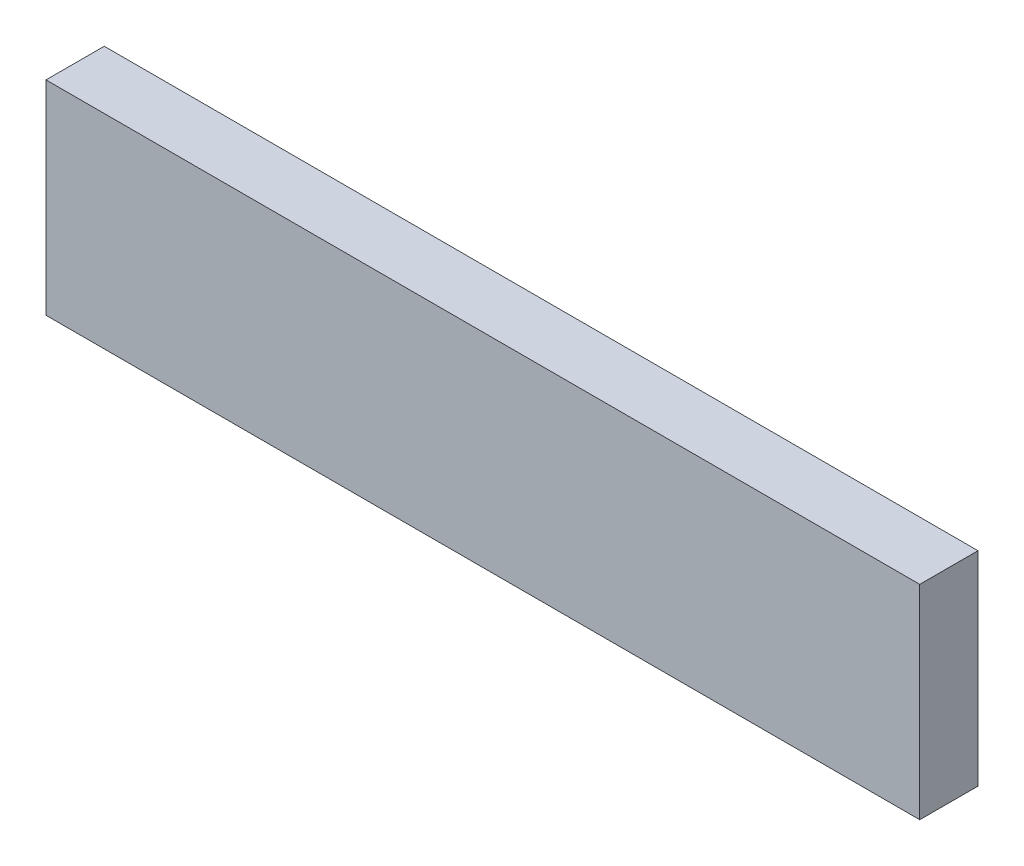
from build123d import *

# Parameters (mm, degrees)
SKETCH_1_W      = 300
SKETCH_1_H      = 70
EXTRUDE_1_DEPTH = 20


with BuildPart() as part:
    # 草图1 → 凸台-拉伸1 (new body)
    with BuildSketch(Plane.XY):
        Rectangle(SKETCH_1_W, SKETCH_1_H)
    extrude(amount=EXTRUDE_1_DEPTH)


solid = part.part
